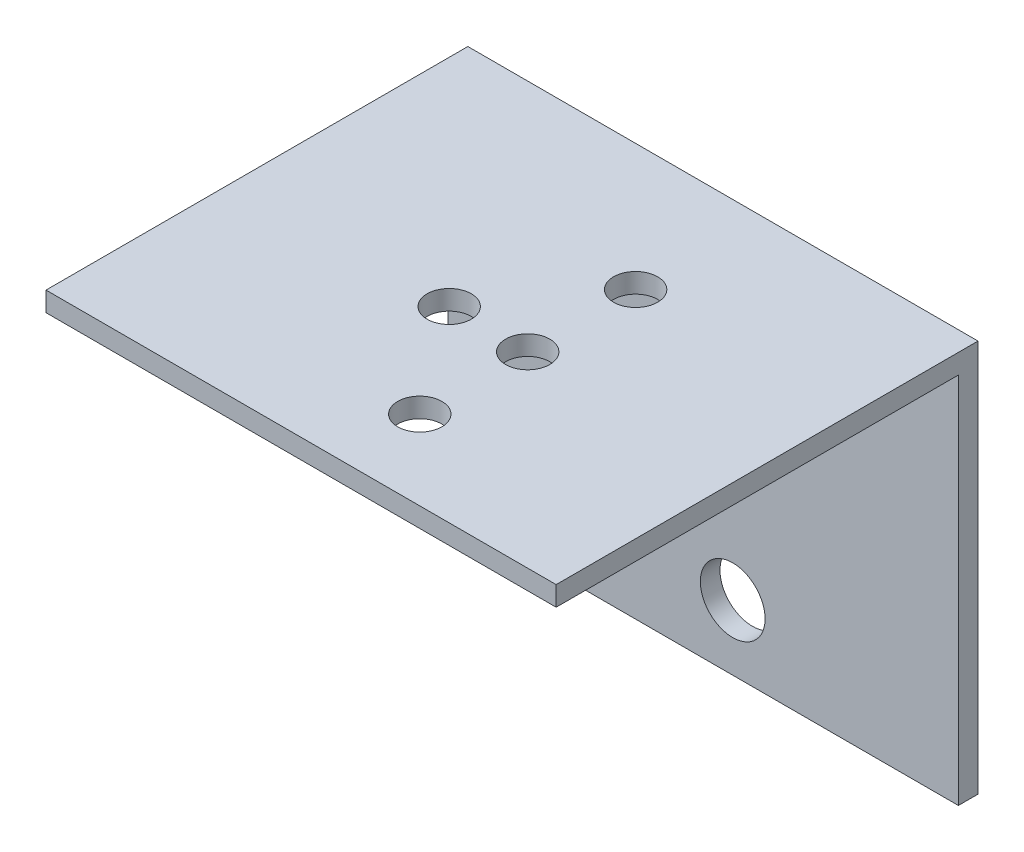
from build123d import *

# Parameters (mm, degrees)
ESQUISSE1_W             = 52
ESQUISSE1_H             = 40
BOSS_EXTRU_1_DEPTH      = 43
ESQUISSE2_W             = 48.222048012
ESQUISSE2_H             = 36
ENL_V_MAT_EXTRU_1_DEPTH = 50
ESQUISSE3_W             = 72.686110251
ESQUISSE3_H             = 50.534375484
ENL_V_MAT_EXTRU_2_DEPTH = 38
D_GAGEMENT_M61_D        = 6.6
D_GAGEMENT_M41_D        = 4.5


with BuildPart() as part:
    # Esquisse1 → Boss.-Extru.1 (new body)
    with BuildSketch(Plane.XY):
        Rectangle(ESQUISSE1_W, ESQUISSE1_H)
    extrude(amount=BOSS_EXTRU_1_DEPTH)

    # Esquisse2 → Enlèv. mat.-Extru.1 (cut)
    with BuildSketch(Plane.ZY.offset(26)):
        with Locations((26.111024006, 0)):
            Rectangle(ESQUISSE2_W, ESQUISSE2_H)
    extrude(amount=-ENL_V_MAT_EXTRU_1_DEPTH, mode=Mode.SUBTRACT)

    # Esquisse3 → Enlèv. mat.-Extru.2 (cut)
    with BuildSketch(Plane.XZ.offset(20)):
        with Locations((1.657877156, 27.267187742)):
            Rectangle(ESQUISSE3_W, ESQUISSE3_H)
    extrude(amount=-ENL_V_MAT_EXTRU_2_DEPTH, mode=Mode.SUBTRACT)

    # Dégagement M61 (through all)
    with Locations(Plane.XY.offset(2)):
        with Locations((2.997387754, 9.32052376), (-16.442863145, 9.32052376), (-16.442863145, -13.378539167), (2.997387754, -13.378539167)):
            Hole(D_GAGEMENT_M61_D / 2)

    # Dégagement M41 (through all)
    with Locations(Plane(origin=(0, 18, 0), x_dir=(-1, 0, 0), z_dir=(0, -1, 0))):
        with Locations((-4, -34.9), (-4, -23.9), (-4, -12.9), (4, -23.9)):
            Hole(D_GAGEMENT_M41_D / 2)


solid = part.part
